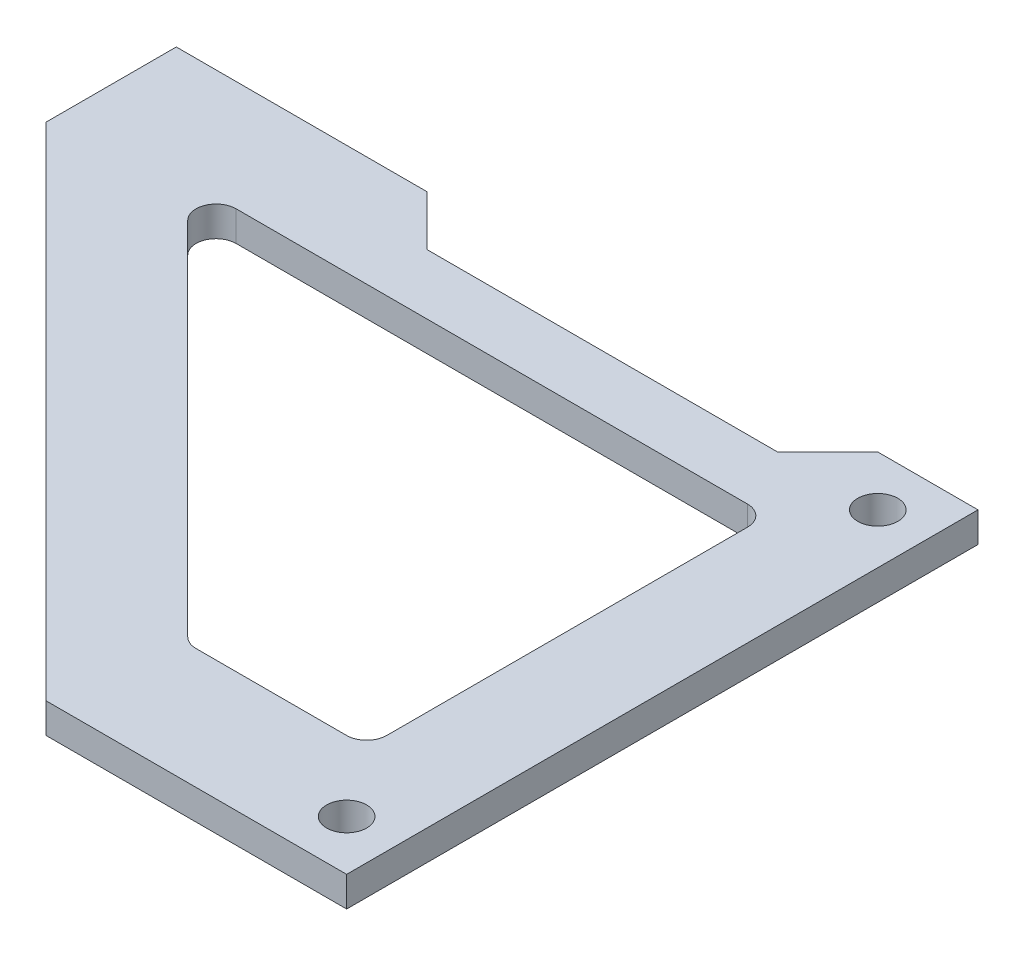
from build123d import *

# Parameters (mm, degrees)
SKETCH_1_W          = 280
SKETCH_1_H          = 63
SKETCH_1_R          = 2
EXTRUDE_1_DEPTH     = 3
CUT_EXTRUDE_1_DEPTH = 3
SKETCH_3_W          = 200
SKETCH_3_H          = 63
CUT_EXTRUDE_2_DEPTH = 10
CUT_EXTRUDE_3_DEPTH = 10
CUT_EXTRUDE_4_DEPTH = 10
FILLET_1_R          = 2


with BuildPart() as part:
    # 草图1 → 凸台-拉伸1 (new body)
    with BuildSketch(Plane(origin=(0, 0, 0), x_dir=(1, 0, 0), z_dir=(0, 1, 0))):
        Rectangle(SKETCH_1_W, SKETCH_1_H)
        with Locations(Location((-65, 26.5, 0), (0, 0, 270))):
            Circle(SKETCH_1_R, mode=Mode.SUBTRACT)
        with Locations(Location((-65, -26.5, 0), (0, 0, 270))):
            Circle(SKETCH_1_R, mode=Mode.SUBTRACT)
        with Locations(Location((65, -26.5, 0), (0, 0, 90))):
            Circle(SKETCH_1_R, mode=Mode.SUBTRACT)
        with Locations(Location((65, 26.5, 0), (0, 0, 90))):
            Circle(SKETCH_1_R, mode=Mode.SUBTRACT)
    extrude(amount=EXTRUDE_1_DEPTH)

    # 草图2 → 切除-拉伸1 (cut)
    with BuildSketch(Plane(origin=(0, 3, 0), x_dir=(1, 0, 0), z_dir=(0, 1, 0))):
        Polygon((-140, 18.5), (-140, -31.5), (-90, -31.5), align=None)
        Polygon((90, -31.5), (140, 18.5), (140, -31.5), align=None)
    extrude(amount=-CUT_EXTRUDE_1_DEPTH, mode=Mode.SUBTRACT)

    # 草图3 → 切除-拉伸2 (cut)
    with BuildSketch(Plane(origin=(0, 3, 0), x_dir=(1, 0, 0), z_dir=(0, 1, 0))):
        with Locations((40, 0)):
            Rectangle(SKETCH_3_W, SKETCH_3_H)
    extrude(amount=-CUT_EXTRUDE_2_DEPTH, mode=Mode.SUBTRACT)

    # 草图4 → 切除-拉伸3 (cut)
    with BuildSketch(Plane(origin=(0, 3, 0), x_dir=(1, 0, 0), z_dir=(0, 1, 0))):
        Polygon((-115, 31.5), (-110, 26.5), (-75, 26.5), (-70, 31.5), align=None)
    extrude(amount=-CUT_EXTRUDE_3_DEPTH, mode=Mode.SUBTRACT)

    # 草图5 → 切除-拉伸4 (cut)
    with BuildSketch(Plane(origin=(0, 3, 0), x_dir=(1, 0, 0), z_dir=(0, 1, 0))):
        Polygon((-127.857864376, 20.5), (-70, 20.5), (-70, -19.5), (-87.857864376, -19.5), align=None)
    extrude(amount=-CUT_EXTRUDE_4_DEPTH, mode=Mode.SUBTRACT)

    # 圆角1
    fillet_1_edges = [part.edges().sort_by_distance(p)[0] for p in [
        (-70, 1.5, -20.5),
        (-70, 1.5, 19.5),
        (-87.857864376, 1.5, 19.5),
        (-127.857864376, 1.5, -20.5),
    ]]
    fillet(fillet_1_edges, radius=FILLET_1_R)


solid = part.part
